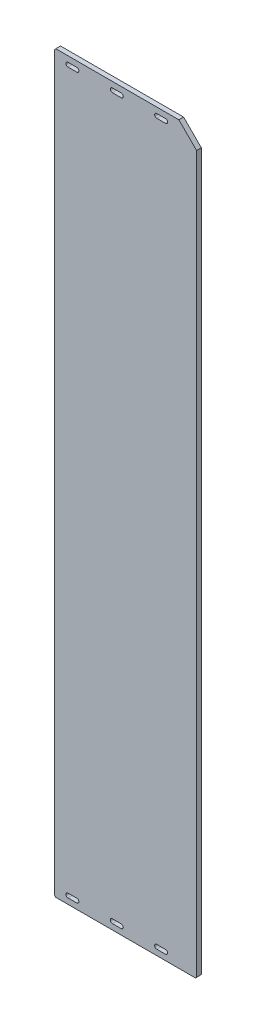
from build123d import *

# Parameters (mm, degrees)
SKETCH_1_W          = 240
SKETCH_1_H          = 1242
EXTRUDE_1_DEPTH     = 8
CHAMFER_1_SIZE      = 30
CHAMFER_2_SIZE      = 2
CUT_EXTRUDE_1_DEPTH = 10


with BuildPart() as part:
    # 草图1 → 凸台-拉伸1 (new body)
    with BuildSketch(Plane.XY):
        Rectangle(SKETCH_1_W, SKETCH_1_H)
    extrude(amount=EXTRUDE_1_DEPTH)

    # 倒角1
    chamfer_1_edges = [part.edges().sort_by_distance(p)[0] for p in [
        (120, 621, 4),
    ]]
    chamfer(chamfer_1_edges, length=CHAMFER_1_SIZE)

    # 倒角2
    chamfer_2_edges = [part.edges().sort_by_distance(p)[0] for p in [
        (120, -621, 4),
        (-120, -621, 4),
        (-120, 621, 4),
    ]]
    chamfer(chamfer_2_edges, length=CHAMFER_2_SIZE)

    # 草图2 → 切除-拉伸1 (cut)
    with BuildSketch(Plane(origin=(0, 0, 0), x_dir=(-1, 0, 0), z_dir=(0, 0, -1))):
        with BuildLine():
            Line((-67.5, 611.5), (-52.5, 611.5))
            ThreePointArc((-52.5, 611.5), (-49, 608), (-52.5, 604.5))
            Line((-52.5, 604.5), (-67.5, 604.5))
            ThreePointArc((-67.5, 604.5), (-71, 608), (-67.5, 611.5))
        make_face()
        with BuildLine():
            Line((7.5, 611.5), (22.5, 611.5))
            ThreePointArc((22.5, 611.5), (26, 608), (22.5, 604.5))
            Line((22.5, 604.5), (7.5, 604.5))
            ThreePointArc((7.5, 604.5), (4, 608), (7.5, 611.5))
        make_face()
        with BuildLine():
            Line((82.5, 611.5), (97.5, 611.5))
            ThreePointArc((97.5, 611.5), (101, 608), (97.5, 604.5))
            Line((97.5, 604.5), (82.5, 604.5))
            ThreePointArc((82.5, 604.5), (79, 608), (82.5, 611.5))
        make_face()
        with BuildLine():
            Line((-67.5, -611.5), (-52.5, -611.5))
            ThreePointArc((-52.5, -611.5), (-49, -608), (-52.5, -604.5))
            Line((-52.5, -604.5), (-67.5, -604.5))
            ThreePointArc((-67.5, -604.5), (-71, -608), (-67.5, -611.5))
        make_face()
        with BuildLine():
            Line((7.5, -611.5), (22.5, -611.5))
            ThreePointArc((22.5, -611.5), (26, -608), (22.5, -604.5))
            Line((22.5, -604.5), (7.5, -604.5))
            ThreePointArc((7.5, -604.5), (4, -608), (7.5, -611.5))
        make_face()
        with BuildLine():
            Line((82.5, -611.5), (97.5, -611.5))
            ThreePointArc((97.5, -611.5), (101, -608), (97.5, -604.5))
            Line((97.5, -604.5), (82.5, -604.5))
            ThreePointArc((82.5, -604.5), (79, -608), (82.5, -611.5))
        make_face()
    extrude(amount=-CUT_EXTRUDE_1_DEPTH, mode=Mode.SUBTRACT)


solid = part.part
